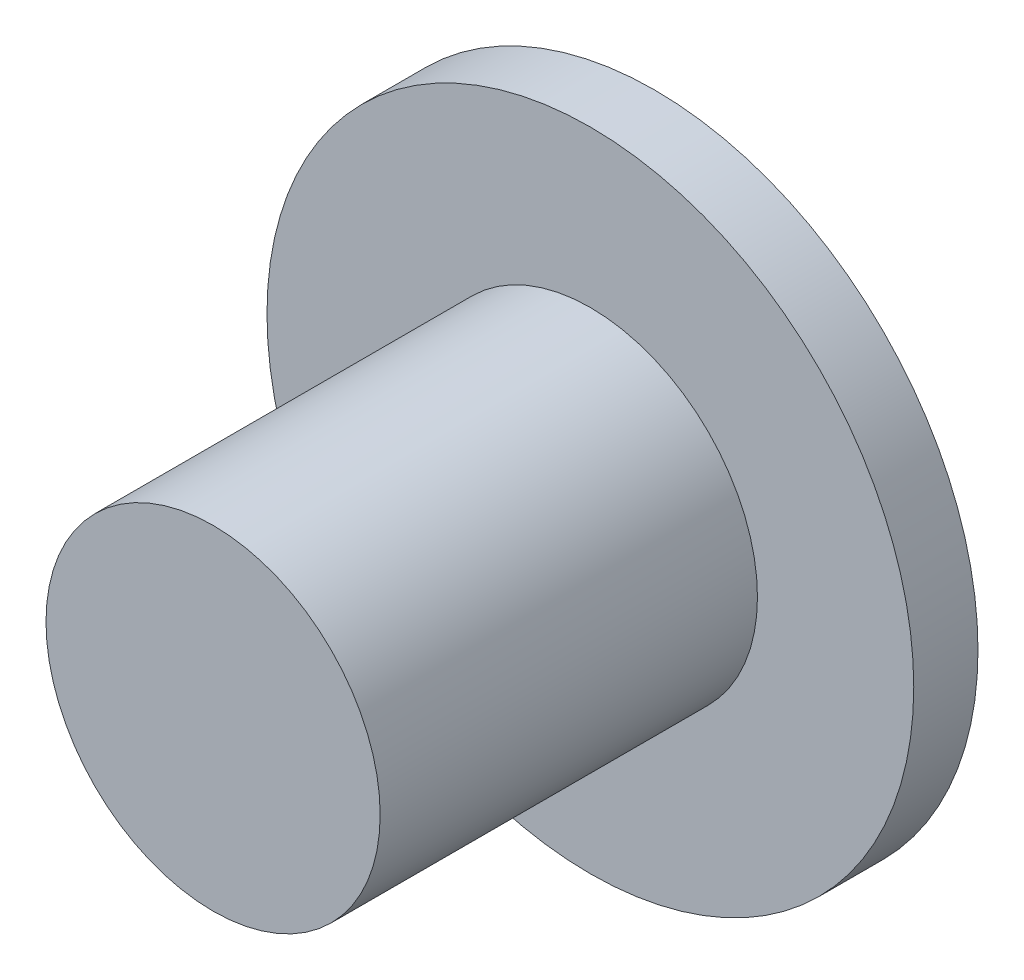
from build123d import *

# Parameters (mm, degrees)
SKETCH1_R           = 3
BOSS_EXTRUDE1_DEPTH = 1
SKETCH2_R           = 1.55
BOSS_EXTRUDE2_DEPTH = 3.5
CHAMFER1_SIZE       = 0.7
CHAMFER1_SIZE2      = 0.404145188
SKETCH3_R           = 1.15
CUT_EXTRUDE1_DEPTH  = 0.2
SKETCH4_R           = 0.85
BOSS_EXTRUDE3_DEPTH = 0.2


with BuildPart() as part:
    # Sketch1 → Boss-Extrude1 (new body)
    with BuildSketch(Plane.XY):
        Circle(SKETCH1_R)
    extrude(amount=BOSS_EXTRUDE1_DEPTH)

    # Sketch2 → Boss-Extrude2 (add)
    with BuildSketch(Plane.XY.offset(1)):
        Circle(SKETCH2_R)
    extrude(amount=BOSS_EXTRUDE2_DEPTH)

    # Chamfer1
    chamfer1_edges = [part.edges().sort_by_distance(p)[0] for p in [
        (-3, 0, 0),
    ]]
    chamfer1_side = [part.faces().sort_by_distance(p)[0] for p in [
        (0, 0, 0),
    ]]
    chamfer(chamfer1_edges, length=CHAMFER1_SIZE, length2=CHAMFER1_SIZE2, reference=chamfer1_side[0])

    # Sketch3 → Cut-Extrude1 (cut)
    with BuildSketch(Plane(origin=(0, 0, 0), x_dir=(-1, 0, 0), z_dir=(0, 0, -1))):
        Circle(SKETCH3_R)
    extrude(amount=-CUT_EXTRUDE1_DEPTH, mode=Mode.SUBTRACT)

    # Sketch4 → Boss-Extrude3 (add)
    with BuildSketch(Plane(origin=(0, 0, 0.2), x_dir=(-1, 0, 0), z_dir=(0, 0, -1))):
        Circle(SKETCH4_R)
    extrude(amount=BOSS_EXTRUDE3_DEPTH)


solid = part.part
